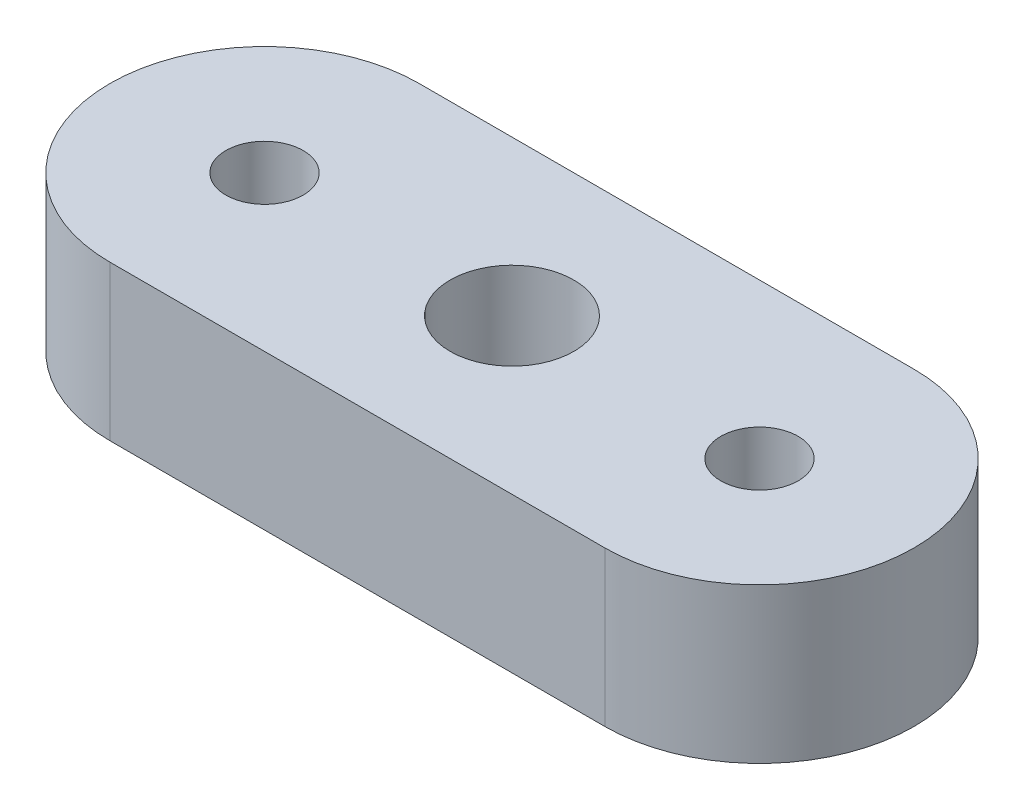
from build123d import *

# Parameters (mm, degrees)
RESSALTO_EXTRUS_O1_DEPTH      = 5
RESSALTO_EXTRUS_O1_DEPTH_BACK = 5
CORTE_EXTRUS_O1_DEPTH         = 5
CORTE_EXTRUS_O1_DEPTH_BACK    = 5
ESBO_O1_R                     = 4
ESBO_O1_R_2                   = 2.5


with BuildPart() as part:
    # Esboço2 → Ressalto-extrusão1 (new, two sides: drawn at the far end of the back side and taken through both)
    with BuildSketch(Plane(origin=(0, 0, 0), x_dir=(1, 0, 0), z_dir=(0, 1, 0)).offset(-RESSALTO_EXTRUS_O1_DEPTH_BACK)):
        with BuildLine():
            Line((16, 10), (-16, 10))
            ThreePointArc((-16, 10), (-26, 0), (-16, -10))
            Line((-16, -10), (16, -10))
            ThreePointArc((16, -10), (26, 0), (16, 10))
        make_face()
    extrude(amount=RESSALTO_EXTRUS_O1_DEPTH + RESSALTO_EXTRUS_O1_DEPTH_BACK)

    # Esboço1 → Corte-extrusão1 (cut, two sides: drawn at the far end of the back side and taken through both)
    with BuildSketch(Plane(origin=(0, 0, 0), x_dir=(1, 0, 0), z_dir=(0, 1, 0)).offset(-CORTE_EXTRUS_O1_DEPTH_BACK)):
        Circle(ESBO_O1_R)
        with Locations((16, 0)):
            Circle(ESBO_O1_R_2)
        with Locations((-16, 0)):
            Circle(ESBO_O1_R_2)
    extrude(amount=CORTE_EXTRUS_O1_DEPTH + CORTE_EXTRUS_O1_DEPTH_BACK, mode=Mode.SUBTRACT)


solid = part.part
